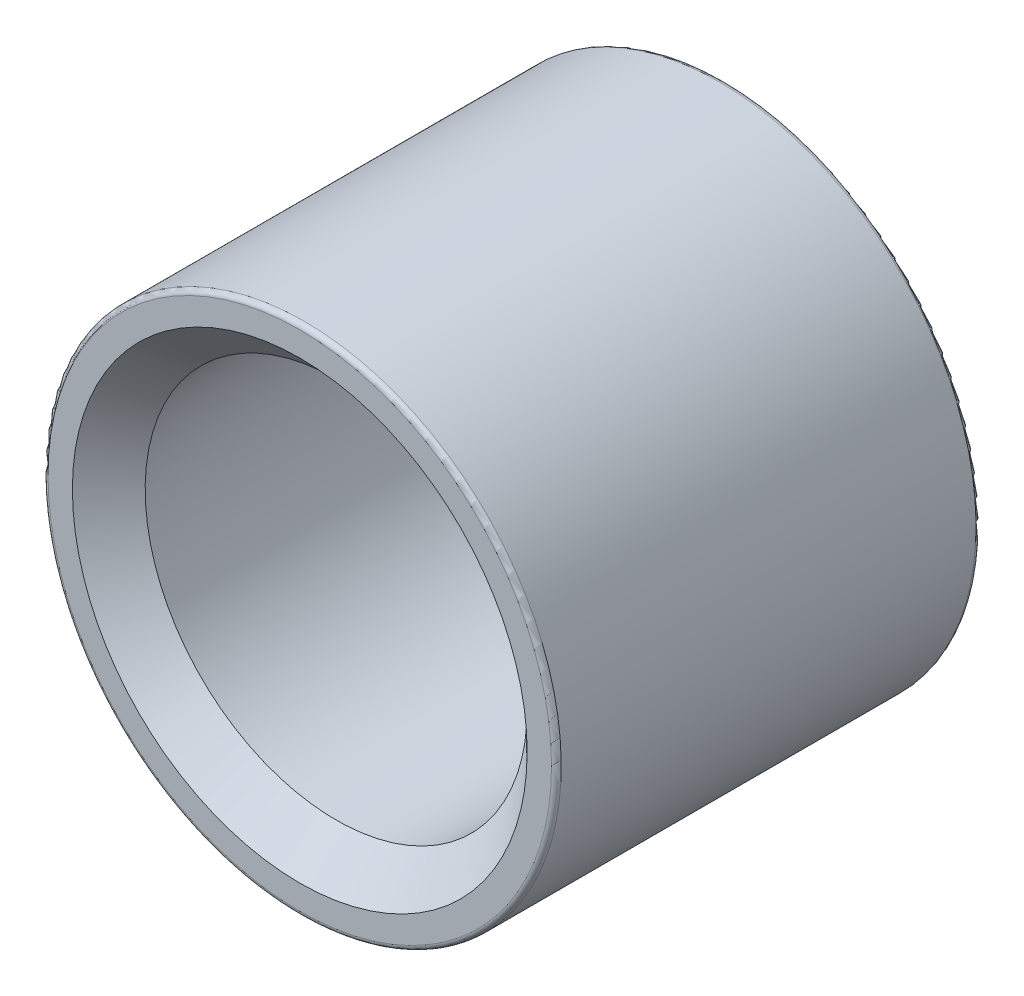
from build123d import *


with BuildPart() as part:
    # Sketch2 → Revolve1 (revolve)
    with BuildSketch(Plane(origin=(0, 0, 0), x_dir=(0, 0, -1), z_dir=(1, 0, 0))):
        with BuildLine():
            Line((-14.795, 9.374), (-14.795, 10.3791))
            ThreePointArc((-14.795, 10.3791), (-14.736421356, 10.520521356), (-14.595, 10.5791))
            Line((-14.595, 10.5791), (2.505, 10.5791))
            ThreePointArc((2.505, 10.5791), (2.646421356, 10.520521356), (2.705, 10.3791))
            Line((2.705, 10.3791), (2.705, 0))
            Line((2.705, 0), (0, 0))
            Line((0, 0), (0, 7.874))
            Line((0, 7.874), (-13.295, 7.874))
            Line((-13.295, 7.874), (-14.795, 9.374))
        make_face()
    revolve(axis=Axis((0, 0, -2.705), (0, 0, 1)))


solid = part.part
